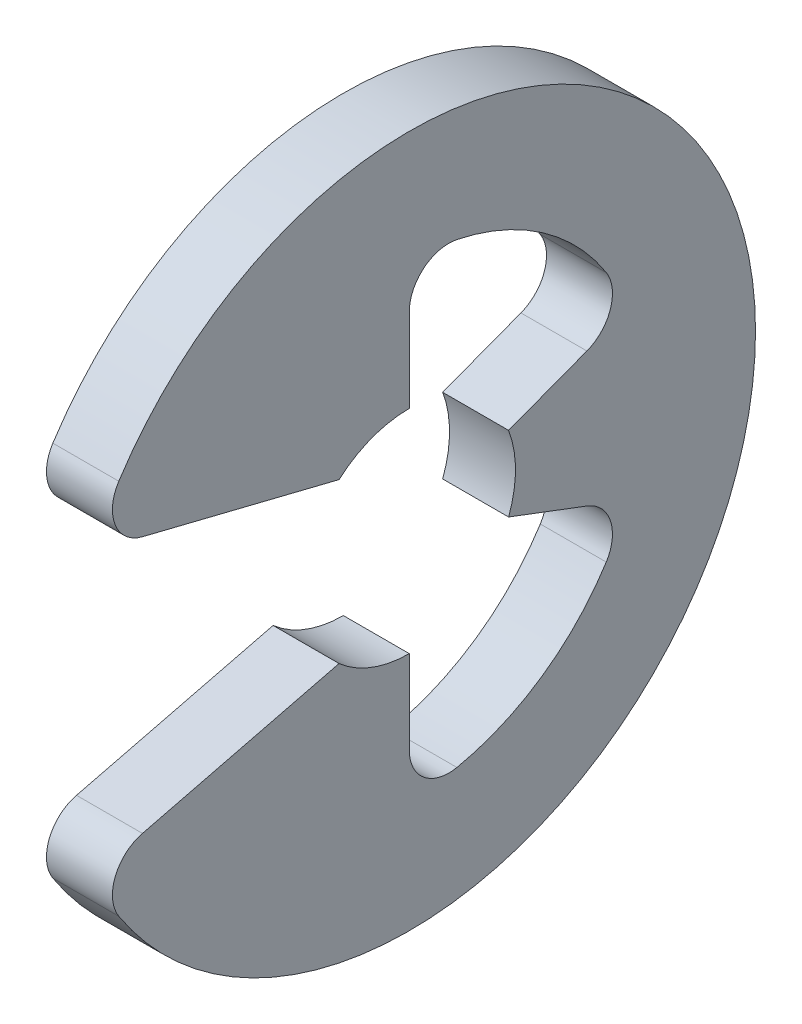
from build123d import *

# Parameters (mm, degrees)
BOSS_EXTRUDE1_DEPTH = 0.5


with BuildPart() as part:
    # Sketch1 → Boss-Extrude1 (new body)
    with BuildSketch(Plane(origin=(-0.25, 0, 0), x_dir=(0, -1, 0), z_dir=(-1, 0, 0))):
        with BuildLine():
            Line((0.973814574, 2.023045102), (0.60375, 0.532457451))
            ThreePointArc((0.60375, 0.532457451), (0.753008549, 0.284610479), (0.805, 0))
            Line((0.805, 0), (1.439391709, 0))
            ThreePointArc((1.439391709, 0), (1.672161248, -0.110742658), (1.733080671, -0.361211057))
            ThreePointArc((1.733080671, -0.361211057), (1.456381342, -1.006476738), (0.950618553, -1.493441129))
            ThreePointArc((0.950618553, -1.493441129), (0.69478855, -1.525010179), (0.508901819, -1.346427655))
            Line((0.508901819, -1.346427655), (0.284610479, -0.753008549))
            ThreePointArc((0.284610479, -0.753008549), (0, -0.805), (-0.284610479, -0.753008549))
            Line((-0.284610479, -0.753008549), (-0.508901819, -1.346427655))
            ThreePointArc((-0.508901819, -1.346427655), (-0.69478855, -1.525010179), (-0.950618553, -1.493441129))
            ThreePointArc((-0.950618553, -1.493441129), (-1.456381342, -1.006476738), (-1.733080671, -0.361211057))
            ThreePointArc((-1.733080671, -0.361211057), (-1.672161248, -0.110742658), (-1.439391709, 0))
            Line((-1.439391709, 0), (-0.805, 0))
            ThreePointArc((-0.805, 0), (-0.753008549, 0.284610479), (-0.60375, 0.532457451))
            Line((-0.60375, 0.532457451), (-0.973814574, 2.023045102))
            ThreePointArc((-0.973814574, 2.023045102), (-1.154792173, 2.2297926), (-1.428198284, 2.202470127))
            ThreePointArc((-1.428198284, 2.202470127), (0, -2.625), (1.428198284, 2.202470127))
            ThreePointArc((1.428198284, 2.202470127), (1.154792173, 2.2297926), (0.973814574, 2.023045102))
        make_face()
    extrude(amount=-BOSS_EXTRUDE1_DEPTH)


solid = part.part
